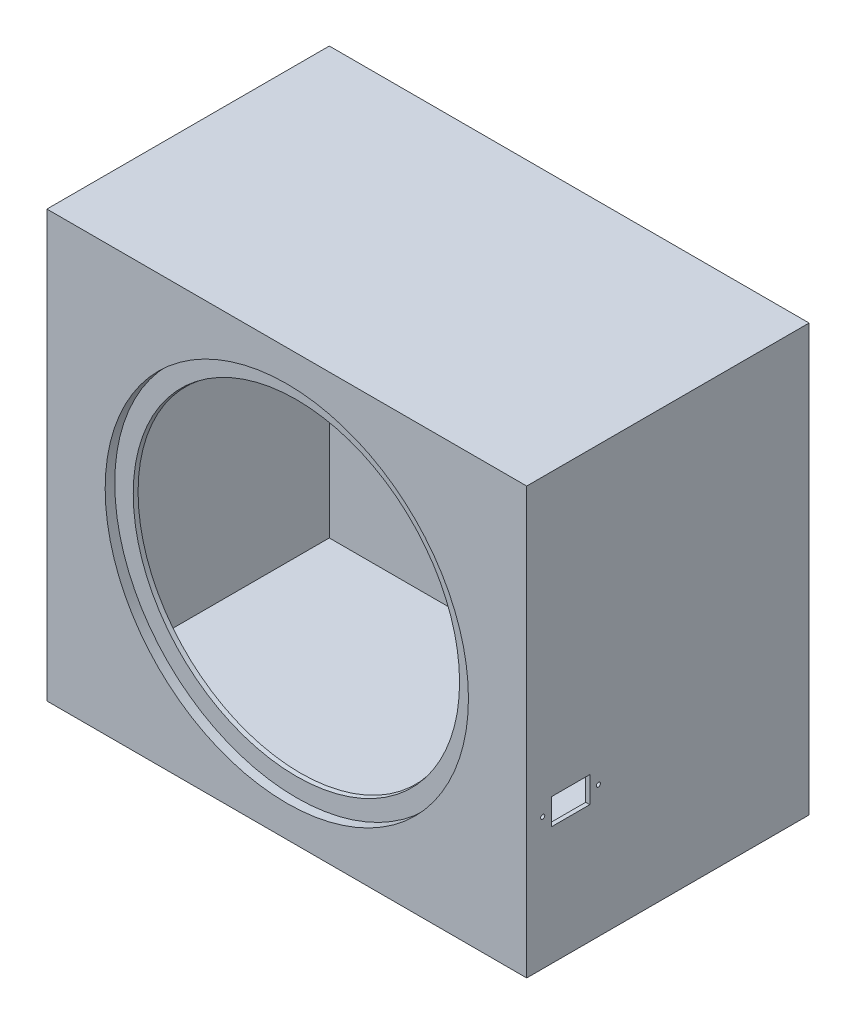
from build123d import *

# Parameters (mm, degrees)
SKETCH1_W           = 300
SKETCH1_H           = 304.8
BOSS_EXTRUDE1_DEPTH = 200
BOSS_EXTRUDE3_DEPTH = 304.8
SHELL1_T            = 3
CUT_EXTRUDE3_REACH  = 435.426
SKETCH8_R           = 2.65
CUT_EXTRUDE4_REACH  = 435.426
SKETCH9_R           = 1.5
SKETCH9_W           = 28
SKETCH9_H           = 19


with BuildPart() as part:
    # Sketch1 → Boss-Extrude1 (new body)
    with BuildSketch(Plane.XY):
        Rectangle(SKETCH1_W, SKETCH1_H)
    extrude(amount=-BOSS_EXTRUDE1_DEPTH)

    # Sketch7 → Boss-Extrude3 (add, through all)
    with BuildSketch(Plane.XZ.offset(152.4)):
        Polygon((-172, -200), (-172, -127.5), (-172, 0), (172, 0), (172, -127.5), (172, -200), align=None)
    extrude(amount=-BOSS_EXTRUDE3_DEPTH)

    # Sketch2 → Cut-Revolve1 (revolve, cut)
    with BuildSketch(Plane(origin=(0, 0, 0), x_dir=(1, 0, 0), z_dir=(0, 1, 0))):
        Polygon((0, 0), (135.5, 0), (135.5, 7), (118.5, 7), (111.799574733, 45), (0, 45), align=None)
    revolve(axis=Axis((0, 0, 0), (0, 0, -1)), mode=Mode.SUBTRACT)

    # Shell1
    shell1_openings = [part.faces().sort_by_distance(p)[0] for p in [
        (-115.149787367, 0, -26),
        (0, 0, -45),
    ]]
    offset(amount=SHELL1_T, openings=shell1_openings, kind=Kind.INTERSECTION)

    # Sketch8 → Cut-Extrude3 (cut, up to next)
    with BuildSketch(Plane.ZY.offset(175), mode=Mode.PRIVATE) as cut_extrude3_sk1:
        with Locations((-40.65, -121.75)):
            Circle(SKETCH8_R)
    cut_extrude3_tool1 = extrude(cut_extrude3_sk1.sketch, amount=-CUT_EXTRUDE3_REACH, mode=Mode.PRIVATE) & part.part
    # Sketch8 → Cut-Extrude3 (cut, up to next)
    with BuildSketch(Plane.ZY.offset(175), mode=Mode.PRIVATE) as cut_extrude3_sk2:
        with Locations((-22, -121.75)):
            Circle(SKETCH8_R)
    cut_extrude3_tool2 = extrude(cut_extrude3_sk2.sketch, amount=-CUT_EXTRUDE3_REACH, mode=Mode.PRIVATE) & part.part
    # Sketch8 → Cut-Extrude3 (cut, up to next)
    with BuildSketch(Plane.ZY.offset(175), mode=Mode.PRIVATE) as cut_extrude3_sk3:
        with Locations((-22, -140.4)):
            Circle(SKETCH8_R)
    cut_extrude3_tool3 = extrude(cut_extrude3_sk3.sketch, amount=-CUT_EXTRUDE3_REACH, mode=Mode.PRIVATE) & part.part
    # Sketch8 → Cut-Extrude3 (cut, up to next)
    with BuildSketch(Plane.ZY.offset(175), mode=Mode.PRIVATE) as cut_extrude3_sk4:
        with Locations((-40.65, -140.4)):
            Circle(SKETCH8_R)
    cut_extrude3_tool4 = extrude(cut_extrude3_sk4.sketch, amount=-CUT_EXTRUDE3_REACH, mode=Mode.PRIVATE) & part.part
    add(cut_extrude3_tool1.solids().sort_by_distance((-175, -121.75, -40.65))[0], mode=Mode.SUBTRACT)
    add(cut_extrude3_tool2.solids().sort_by_distance((-175, -121.75, -22))[0], mode=Mode.SUBTRACT)
    add(cut_extrude3_tool3.solids().sort_by_distance((-175, -140.4, -22))[0], mode=Mode.SUBTRACT)
    add(cut_extrude3_tool4.solids().sort_by_distance((-175, -140.4, -40.65))[0], mode=Mode.SUBTRACT)

    # Sketch9 → Cut-Extrude4 (cut, up to next)
    with BuildSketch(Plane(origin=(175, 0, 0), x_dir=(0, 0, -1), z_dir=(1, 0, 0)), mode=Mode.PRIVATE) as cut_extrude4_sk1:
        with Locations((8.68, -59.4)):
            Circle(SKETCH9_R)
    cut_extrude4_tool1 = extrude(cut_extrude4_sk1.sketch, amount=-CUT_EXTRUDE4_REACH, mode=Mode.PRIVATE) & part.part
    # Sketch9 → Cut-Extrude4 (cut, up to next)
    with BuildSketch(Plane(origin=(175, 0, 0), x_dir=(0, 0, -1), z_dir=(1, 0, 0)), mode=Mode.PRIVATE) as cut_extrude4_sk2:
        with Locations((49.32, -59.4)):
            Circle(SKETCH9_R)
    cut_extrude4_tool2 = extrude(cut_extrude4_sk2.sketch, amount=-CUT_EXTRUDE4_REACH, mode=Mode.PRIVATE) & part.part
    # Sketch9 → Cut-Extrude4 (cut, up to next)
    with BuildSketch(Plane(origin=(175, 0, 0), x_dir=(0, 0, -1), z_dir=(1, 0, 0)), mode=Mode.PRIVATE) as cut_extrude4_sk3:
        with Locations((29, -59.4)):
            Rectangle(SKETCH9_W, SKETCH9_H)
    cut_extrude4_tool3 = extrude(cut_extrude4_sk3.sketch, amount=-CUT_EXTRUDE4_REACH, mode=Mode.PRIVATE) & part.part
    add(cut_extrude4_tool1.solids().sort_by_distance((175, -59.4, -8.68))[0], mode=Mode.SUBTRACT)
    add(cut_extrude4_tool2.solids().sort_by_distance((175, -59.4, -49.32))[0], mode=Mode.SUBTRACT)
    add(cut_extrude4_tool3.solids().sort_by_distance((175, -59.4, -29))[0], mode=Mode.SUBTRACT)


solid = part.part
